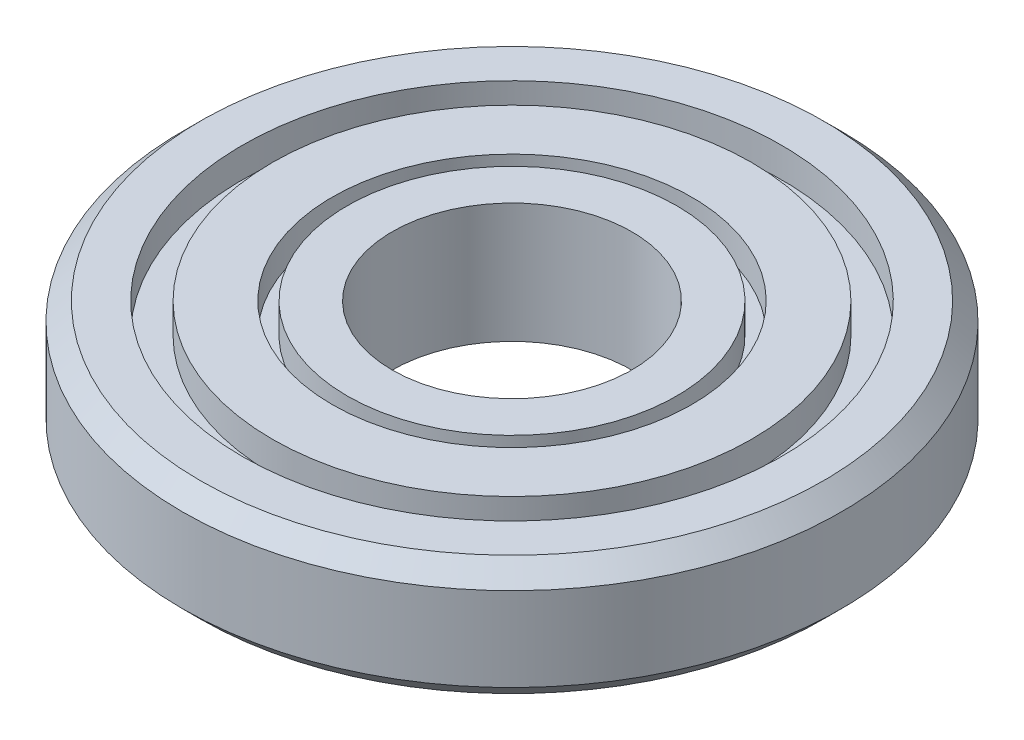
from build123d import *

# Parameters (mm, degrees)
SKETCH1_R           = 5.5
SKETCH1_R_2         = 2
BOSS_EXTRUDE1_DEPTH = 2
SKETCH2_R           = 4.5
SKETCH2_R_2         = 4
SKETCH2_R_3         = 3
SKETCH2_R_4         = 2.75
CUT_EXTRUDE1_DEPTH  = 0.5
CUT_EXTRUDE2_START  = -0.5
SKETCH3_R           = 4.5
SKETCH3_R_2         = 4
SKETCH3_R_3         = 3
SKETCH3_R_4         = 2.75
CUT_EXTRUDE2_DEPTH  = 0.5
CHAMFER1_SIZE       = 0.3


with BuildPart() as part:
    # Sketch1 → Boss-Extrude1 (new body)
    with BuildSketch(Plane(origin=(0, 0, 0), x_dir=(1, 0, 0), z_dir=(0, 1, 0))):
        with Locations(Location((0, 0, 0), (0, 0, 270))):
            Circle(SKETCH1_R)
        with Locations(Location((0, 0, 0), (0, 0, 270))):
            Circle(SKETCH1_R_2, mode=Mode.SUBTRACT)
    extrude(amount=BOSS_EXTRUDE1_DEPTH)

    # Sketch2 → Cut-Extrude1 (cut)
    # profile 1 of 2: a face of its own
    with BuildSketch(Plane(origin=(0, 2, 0), x_dir=(1, 0, 0), z_dir=(0, 1, 0))):
        with Locations(Location((0, 0, 0), (0, 0, 270))):
            Circle(SKETCH2_R)
        with Locations(Location((0, 0, 0), (0, 0, 270))):
            Circle(SKETCH2_R_2, mode=Mode.SUBTRACT)
    # profile 2 of 2: a face of its own
    with BuildSketch(Plane(origin=(0, 2, 0), x_dir=(1, 0, 0), z_dir=(0, 1, 0))):
        with Locations(Location((0, 0, 0), (0, 0, 270))):
            Circle(SKETCH2_R_3)
        with Locations(Location((0, 0, 0), (0, 0, 270))):
            Circle(SKETCH2_R_4, mode=Mode.SUBTRACT)
    extrude(amount=-CUT_EXTRUDE1_DEPTH, mode=Mode.SUBTRACT)

    # Sketch3 → Cut-Extrude2 (cut)
    # profile 1 of 2: a face of its own
    with BuildSketch(Plane.XZ.offset(CUT_EXTRUDE2_START)):
        with Locations(Location((0, 0, 0), (0, 0, 90))):
            Circle(SKETCH3_R)
        with Locations(Location((0, 0, 0), (0, 0, 90))):
            Circle(SKETCH3_R_2, mode=Mode.SUBTRACT)
    # profile 2 of 2: a face of its own
    with BuildSketch(Plane.XZ.offset(CUT_EXTRUDE2_START)):
        with Locations(Location((0, 0, 0), (0, 0, 90))):
            Circle(SKETCH3_R_3)
        with Locations(Location((0, 0, 0), (0, 0, 90))):
            Circle(SKETCH3_R_4, mode=Mode.SUBTRACT)
    extrude(amount=CUT_EXTRUDE2_DEPTH, mode=Mode.SUBTRACT)

    # Chamfer1
    chamfer1_edges = [part.edges().sort_by_distance(p)[0] for p in [
        (0, 0, -5.5),
        (0, 2, -5.5),
    ]]
    chamfer(chamfer1_edges, length=CHAMFER1_SIZE)


solid = part.part
